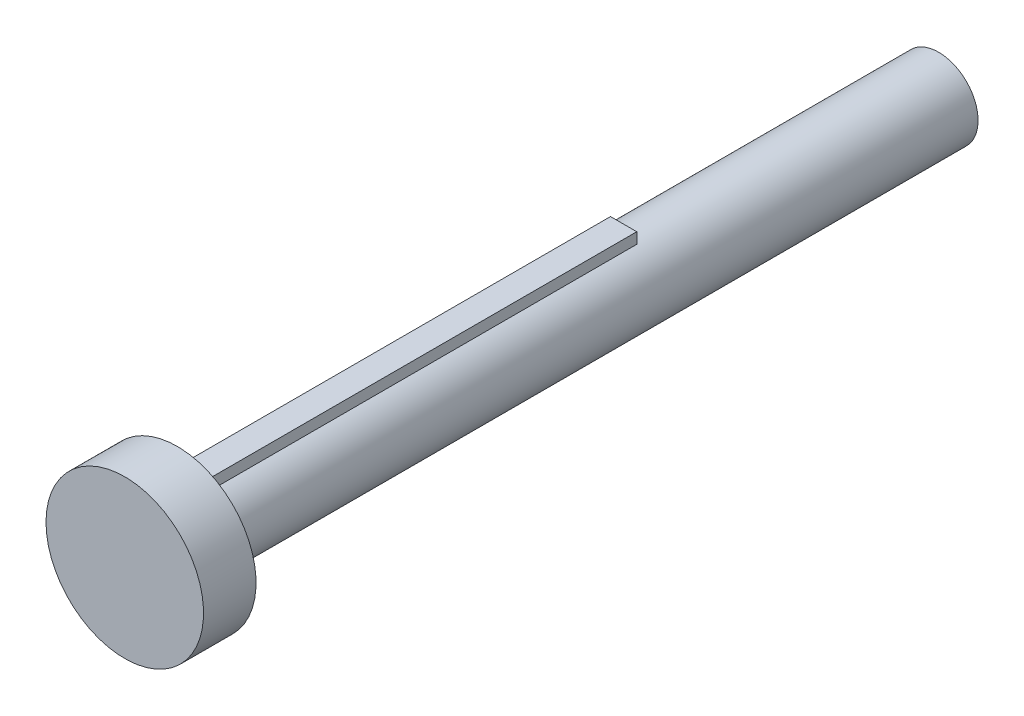
from build123d import *
from build123d.topology import SkipClean

# Parameters (mm, degrees)
BOSS_EXTRUDE1_DEPTH = 800
SKETCH3_R           = 30
BOSS_EXTRUDE3_DEPTH = 20
SKETCH4_R           = 30
CUT_EXTRUDE1_DEPTH  = 1391.647331281
SKETCH5_R           = 15
BOSS_EXTRUDE4_DEPTH = 100
CUT_EXTRUDE2_START  = -20
CUT_EXTRUDE2_DEPTH  = 20


with BuildPart() as part:
    # Sketch1 → Boss-Extrude1 (new, symmetric)
    with BuildSketch(Plane.XY):
        with BuildLine():
            Line((-5, 14.142135624), (-5, 18.3))
            Line((-5, 18.3), (5, 18.3))
            Line((5, 18.3), (5, 14.142135624))
            ThreePointArc((5, 14.142135624), (0, -15), (-5, 14.142135624))
        make_face()
    extrude(amount=BOSS_EXTRUDE1_DEPTH, both=True)

    # Sketch3 → Boss-Extrude3 (add)
    with BuildSketch(Plane(origin=(0, 0, 590), x_dir=(-1, 0, 0), z_dir=(0, 0, -1))):
        Circle(SKETCH3_R)
    boss_extrude3 = extrude(amount=-BOSS_EXTRUDE3_DEPTH)

    # Mirror2: Boss-Extrude3 across plane
    add(boss_extrude3.mirror(Plane.XY))

    # Sketch4 → Cut-Extrude1 (cut, through all)
    with BuildSketch(Plane.XY.offset(-590)):
        with Locations(Location((0, 0, 0), (0, 0, 180))):
            Circle(SKETCH4_R)
    extrude(amount=CUT_EXTRUDE1_DEPTH, mode=Mode.SUBTRACT)

    # Sketch5 → Boss-Extrude4 (add)
    with BuildSketch(Plane(origin=(0, 0, -800), x_dir=(-1, 0, 0), z_dir=(0, 0, -1))):
        Circle(SKETCH5_R)
    extrude(amount=BOSS_EXTRUDE4_DEPTH)

    # Sketch6 → Cut-Extrude2 (cut)
    with SkipClean():  # the faces are left unmerged after this step: merging them gives an invalid solid
        with BuildSketch(Plane(origin=(0, 0, -800), x_dir=(-1, 0, 0), z_dir=(0, 0, -1)).offset(CUT_EXTRUDE2_START)):
            with BuildLine():
                Line((5, 14.142135624), (5, 18.3))
                Line((5, 18.3), (-5, 18.3))
                Line((-5, 18.3), (-5, 14.142135624))
                ThreePointArc((-5, 14.142135624), (0, 15), (5, 14.142135624))
            make_face()
        extrude(amount=CUT_EXTRUDE2_DEPTH, mode=Mode.SUBTRACT)


solid = part.part
